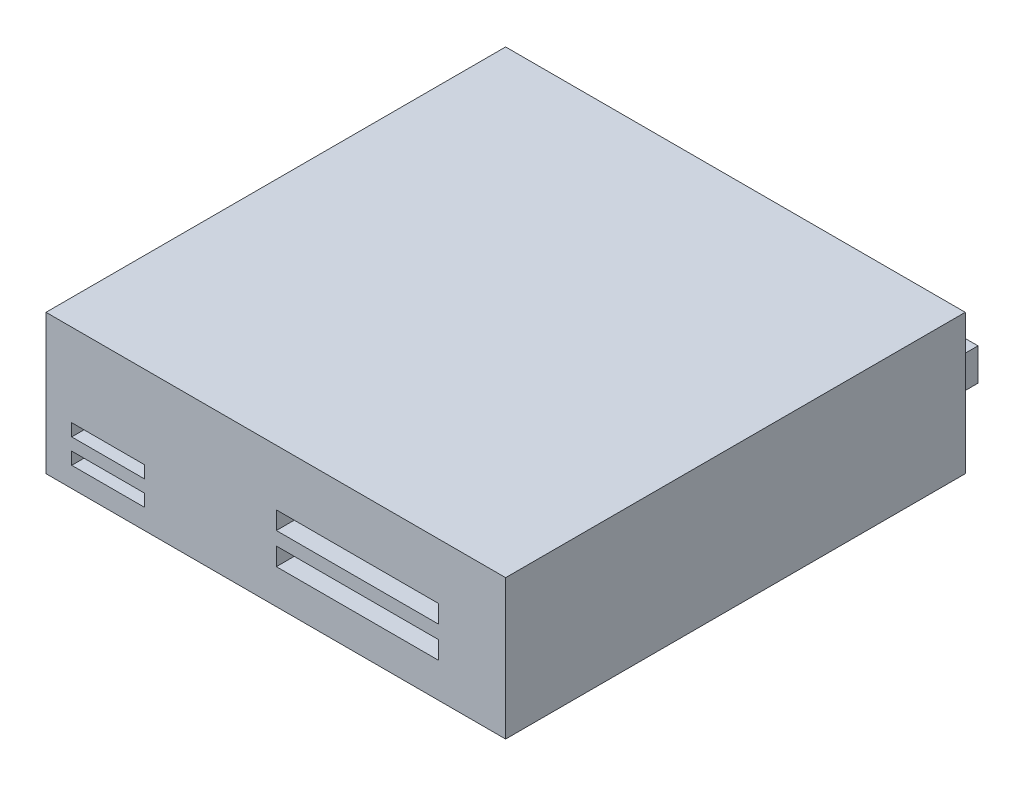
from build123d import *

# Parameters (mm, degrees)
SKETCH1_W           = 41.1
SKETCH1_H           = 41.1
BOSS_EXTRUDE1_DEPTH = 12.5
SKETCH2_W           = 14.5
SKETCH2_H           = 1.6
SKETCH2_W_2         = 6.5
SKETCH2_H_2         = 1.1
CUT_EXTRUDE1_DEPTH  = 30
SKETCH3_W           = 8.369195437
SKETCH3_H           = 2.894608948
BOSS_EXTRUDE2_DEPTH = 3


with BuildPart() as part:
    # Sketch1 → Boss-Extrude1 (new body)
    with BuildSketch(Plane(origin=(0, 0, 0), x_dir=(1, 0, 0), z_dir=(0, 1, 0))):
        Rectangle(SKETCH1_W, SKETCH1_H)
    extrude(amount=BOSS_EXTRUDE1_DEPTH)

    # Sketch2 → Cut-Extrude1 (cut)
    with BuildSketch(Plane.XY.offset(20.55)):
        with Locations((7.3, 6.7)):
            Rectangle(SKETCH2_W, SKETCH2_H)
        with Locations((7.3, 3.9)):
            Rectangle(SKETCH2_W, SKETCH2_H)
        with Locations((-15, 4.55)):
            Rectangle(SKETCH2_W_2, SKETCH2_H_2)
        with Locations((-15, 2.35)):
            Rectangle(SKETCH2_W_2, SKETCH2_H_2)
    extrude(amount=-CUT_EXTRUDE1_DEPTH, mode=Mode.SUBTRACT)

    # Sketch3 → Boss-Extrude2 (add)
    with BuildSketch(Plane(origin=(0, 0, -20.55), x_dir=(-1, 0, 0), z_dir=(0, 0, -1))):
        with Locations((-14.504507882, 6.024959093)):
            Rectangle(SKETCH3_W, SKETCH3_H)
    extrude(amount=BOSS_EXTRUDE2_DEPTH)


solid = part.part
